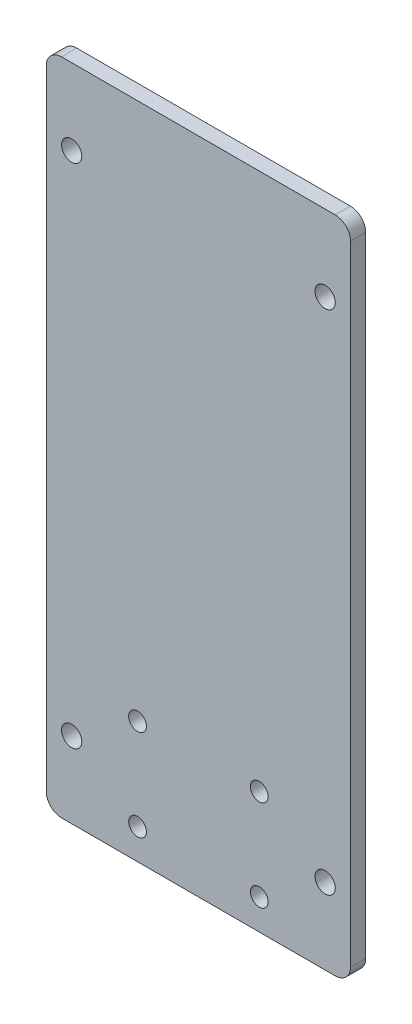
from build123d import *

# Parameters (mm, degrees)
SZKIC1_W                    = 60
SZKIC1_H                    = 130
DODANIE_WYCI_GNI_CIE1_DEPTH = 3
WYTNIJ_WYCI_GNI_CIE1_REACH  = 145.21
SZKIC2_R                    = 2
ZAOKR_GLENIE1_R             = 3
SZKIC3_R                    = 1.75
WYTNIJ_WYCI_GNI_CIE2_DEPTH  = 3


with BuildPart() as part:
    # Szkic1 → Dodanie-wyciągnięcie1 (new body)
    with BuildSketch(Plane.XY):
        with Locations((30, 65)):
            Rectangle(SZKIC1_W, SZKIC1_H)
    extrude(amount=DODANIE_WYCI_GNI_CIE1_DEPTH)

    # Szkic2 → Wytnij-wyciągnięcie1 (cut, up to next)
    with BuildSketch(Plane.XY.offset(3), mode=Mode.PRIVATE) as wytnij_wyci_gni_cie1_sk1:
        with Locations((5, 115)):
            Circle(SZKIC2_R)
    wytnij_wyci_gni_cie1_tool1 = extrude(wytnij_wyci_gni_cie1_sk1.sketch, amount=-WYTNIJ_WYCI_GNI_CIE1_REACH, mode=Mode.PRIVATE) & part.part
    # Szkic2 → Wytnij-wyciągnięcie1 (cut, up to next)
    with BuildSketch(Plane.XY.offset(3), mode=Mode.PRIVATE) as wytnij_wyci_gni_cie1_sk2:
        with Locations((55, 115)):
            Circle(SZKIC2_R)
    wytnij_wyci_gni_cie1_tool2 = extrude(wytnij_wyci_gni_cie1_sk2.sketch, amount=-WYTNIJ_WYCI_GNI_CIE1_REACH, mode=Mode.PRIVATE) & part.part
    # Szkic2 → Wytnij-wyciągnięcie1 (cut, up to next)
    with BuildSketch(Plane.XY.offset(3), mode=Mode.PRIVATE) as wytnij_wyci_gni_cie1_sk3:
        with Locations((5, 15)):
            Circle(SZKIC2_R)
    wytnij_wyci_gni_cie1_tool3 = extrude(wytnij_wyci_gni_cie1_sk3.sketch, amount=-WYTNIJ_WYCI_GNI_CIE1_REACH, mode=Mode.PRIVATE) & part.part
    # Szkic2 → Wytnij-wyciągnięcie1 (cut, up to next)
    with BuildSketch(Plane.XY.offset(3), mode=Mode.PRIVATE) as wytnij_wyci_gni_cie1_sk4:
        with Locations((55, 15)):
            Circle(SZKIC2_R)
    wytnij_wyci_gni_cie1_tool4 = extrude(wytnij_wyci_gni_cie1_sk4.sketch, amount=-WYTNIJ_WYCI_GNI_CIE1_REACH, mode=Mode.PRIVATE) & part.part
    add(wytnij_wyci_gni_cie1_tool1.solids().sort_by_distance((5, 115, 3))[0], mode=Mode.SUBTRACT)
    add(wytnij_wyci_gni_cie1_tool2.solids().sort_by_distance((55, 115, 3))[0], mode=Mode.SUBTRACT)
    add(wytnij_wyci_gni_cie1_tool3.solids().sort_by_distance((5, 15, 3))[0], mode=Mode.SUBTRACT)
    add(wytnij_wyci_gni_cie1_tool4.solids().sort_by_distance((55, 15, 3))[0], mode=Mode.SUBTRACT)

    # Zaokrąglenie1
    zaokr_glenie1_edges = [part.edges().sort_by_distance(p)[0] for p in [
        (0, 130, 1.5),
        (60, 130, 1.5),
        (60, 0, 1.5),
        (0, 0, 1.5),
    ]]
    fillet(zaokr_glenie1_edges, radius=ZAOKR_GLENIE1_R)

    # Szkic3 → Wytnij-wyciągnięcie2 (cut)
    with BuildSketch(Plane.XY.offset(3)):
        with Locations((18, 24)):
            Circle(SZKIC3_R)
        with Locations((42, 24)):
            Circle(SZKIC3_R)
        with Locations((42, 6)):
            Circle(SZKIC3_R)
        with Locations((18, 6)):
            Circle(SZKIC3_R)
    extrude(amount=-WYTNIJ_WYCI_GNI_CIE2_DEPTH, mode=Mode.SUBTRACT)


solid = part.part
